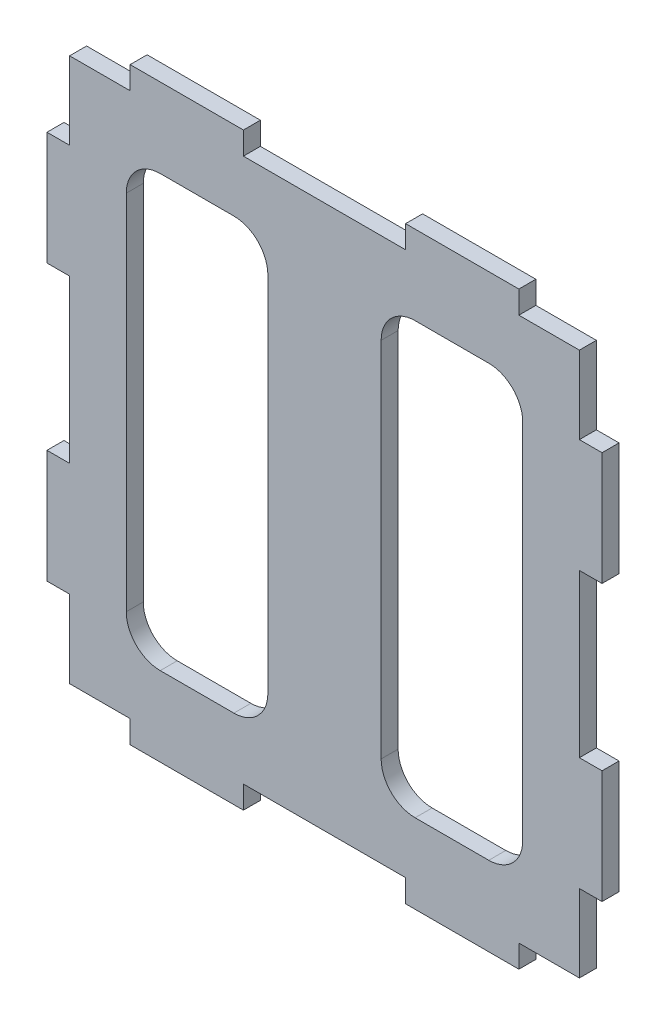
from build123d import *

# Parameters (mm, degrees)
EXTRUDE_1_DEPTH = 1.5


with BuildPart() as part:
    # 草图1 → 凸台-拉伸1 (new body)
    with BuildSketch(Plane.XY):
        Polygon((1932.059632511, 1023.906869704), (1922.059632511, 1023.906869704), (1922.059632511, 1021.906869704), (1916.717816775, 1021.906869704), (1916.717816775, 1015.065053968), (1914.717816775, 1015.065053968), (1914.717816775, 1005.065053968), (1916.717816775, 1005.065053968), (1916.717816775, 990.748685439), (1914.717816775, 990.748685439), (1914.717816775, 980.748685439), (1916.717816775, 980.748685439), (1916.717816775, 973.906869704), (1922.059632511, 973.906869704), (1922.059632511, 971.906869704), (1932.059632511, 971.906869704), (1932.059632511, 973.906869704), (1946.376001039, 973.906869704), (1946.376001039, 971.906869704), (1956.376001039, 971.906869704), (1956.376001039, 973.906869704), (1961.717816775, 973.906869704), (1961.717816775, 980.748685439), (1963.717816775, 980.748685439), (1963.717816775, 990.748685439), (1961.717816775, 990.748685439), (1961.717816775, 1005.065053968), (1963.717816775, 1005.065053968), (1963.717816775, 1015.065053968), (1961.717816775, 1015.065053968), (1961.717816775, 1021.906869704), (1956.376001039, 1021.906869704), (1956.376001039, 1023.906869704), (1946.376001039, 1023.906869704), (1946.376001039, 1021.906869704), (1932.059632511, 1021.906869704), align=None)
        with BuildLine():
            Line((1921.717816775, 1013.906869704), (1921.717816775, 981.906869704))
            ThreePointArc((1921.717816775, 981.906869704), (1922.596496432, 979.78554936), (1924.717816775, 978.906869704))
            Line((1924.717816775, 978.906869704), (1931.217816775, 978.906869704))
            ThreePointArc((1931.217816775, 978.906869704), (1933.339137119, 979.78554936), (1934.217816775, 981.906869704))
            Line((1934.217816775, 981.906869704), (1934.217816775, 1013.906869704))
            ThreePointArc((1934.217816775, 1013.906869704), (1933.339137119, 1016.028190047), (1931.217816775, 1016.906869704))
            Line((1931.217816775, 1016.906869704), (1924.717816775, 1016.906869704))
            ThreePointArc((1924.717816775, 1016.906869704), (1922.596496432, 1016.028190047), (1921.717816775, 1013.906869704))
        make_face(mode=Mode.SUBTRACT)
        with BuildLine():
            Line((1956.717816775, 1013.906869704), (1956.717816775, 981.906869704))
            ThreePointArc((1956.717816775, 981.906869704), (1955.839137119, 979.78554936), (1953.717816775, 978.906869704))
            Line((1953.717816775, 978.906869704), (1947.217816775, 978.906869704))
            ThreePointArc((1947.217816775, 978.906869704), (1945.096496432, 979.78554936), (1944.217816775, 981.906869704))
            Line((1944.217816775, 981.906869704), (1944.217816775, 1013.906869704))
            ThreePointArc((1944.217816775, 1013.906869704), (1945.096496432, 1016.028190047), (1947.217816775, 1016.906869704))
            Line((1947.217816775, 1016.906869704), (1953.717816775, 1016.906869704))
            ThreePointArc((1953.717816775, 1016.906869704), (1955.839137119, 1016.028190047), (1956.717816775, 1013.906869704))
        make_face(mode=Mode.SUBTRACT)
    extrude(amount=EXTRUDE_1_DEPTH)


solid = part.part
